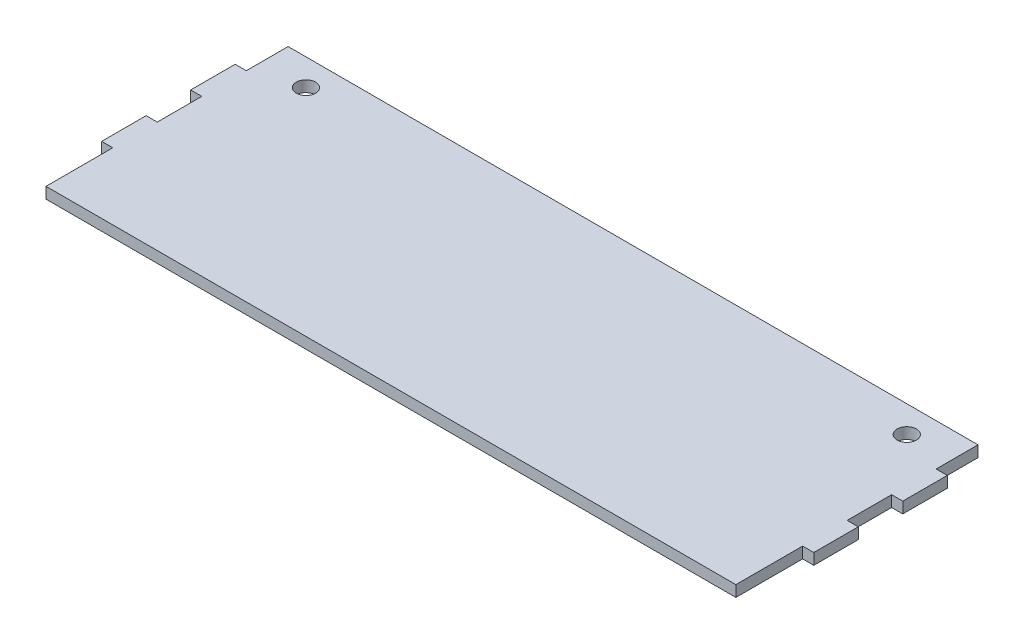
from build123d import *

# Parameters (mm, degrees)
BOSS_EXTRUDE1_DEPTH  = 3.175
M5_CLEARANCE_HOLE1_D = 5.5


with BuildPart() as part:
    # Sketch1 → Boss-Extrude1 (new body)
    with BuildSketch(Plane(origin=(0, 0, 0), x_dir=(1, 0, 0), z_dir=(0, 1, 0))):
        Polygon((101.6, 0), (101.6, 69.088), (3.175, 69.088), (3.175, 57.15), (0, 57.15), (0, 44.45), (3.175, 44.45), (3.175, 31.75), (0, 31.75), (0, 19.05), (3.175, 19.05), (3.175, 0), align=None)
        Polygon((200.025, 69.088), (101.6, 69.088), (101.6, 0), (200.025, 0), (200.025, 19.05), (203.2, 19.05), (203.2, 31.75), (200.025, 31.75), (200.025, 44.45), (203.2, 44.45), (203.2, 57.15), (200.025, 57.15), align=None)
    extrude(amount=BOSS_EXTRUDE1_DEPTH)

    # M5 Clearance Hole1 (through all)
    with Locations(Plane(origin=(0, 3.175, 0), x_dir=(1, 0, 0), z_dir=(0, 1, 0))):
        with Locations((15.875, 61.468), (187.325, 61.468)):
            Hole(M5_CLEARANCE_HOLE1_D / 2)


solid = part.part
